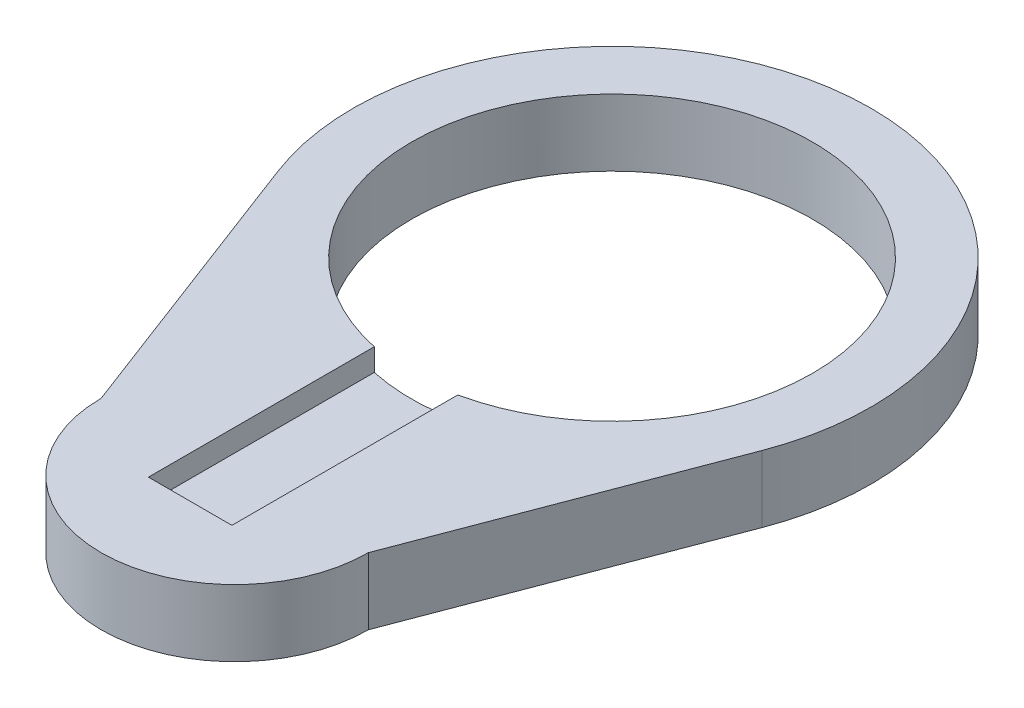
from build123d import *

# Parameters (mm, degrees)
SKETCH1_R           = 18
BOSS_EXTRUDE1_DEPTH = 6
SKETCH2_W           = 7.5
SKETCH2_H           = 21
CUT_EXTRUDE1_DEPTH  = 2


with BuildPart() as part:
    # Sketch1 → Boss-Extrude1 (new body)
    with BuildSketch(Plane(origin=(0, 0, 0), x_dir=(1, 0, 0), z_dir=(0, 1, 0))):
        with BuildLine():
            Line((-21.73544452, 25.635731314), (-12, 0))
            ThreePointArc((-12, 0), (0, -12), (12, 0))
            Line((12, 0), (21.73544452, 25.635731314))
            ThreePointArc((21.73544452, 25.635731314), (0, 57.14), (-21.73544452, 25.635731314))
        make_face()
        with Locations(Location((0, 33.89, 0), (0, 0, 270))):
            Circle(SKETCH1_R, mode=Mode.SUBTRACT)
    extrude(amount=BOSS_EXTRUDE1_DEPTH)

    # Sketch2 → Cut-Extrude1 (cut)
    with BuildSketch(Plane(origin=(0, 6, 0), x_dir=(1, 0, 0), z_dir=(0, 1, 0))):
        with Locations((0, 6.5)):
            Rectangle(SKETCH2_W, SKETCH2_H)
    extrude(amount=-CUT_EXTRUDE1_DEPTH, mode=Mode.SUBTRACT)


solid = part.part
